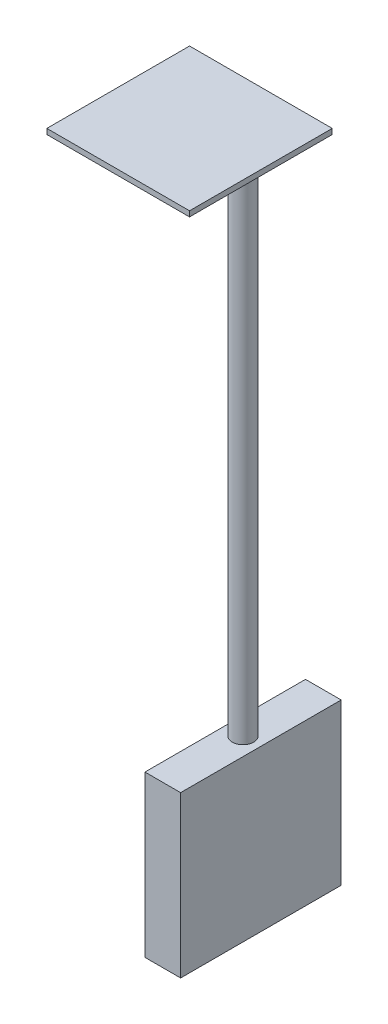
from build123d import *

# Parameters (mm, degrees)
ESQUISSE1_W        = 90
ESQUISSE1_H        = 90
BOSS_EXTRU_1_DEPTH = 20
ESQUISSE2_R        = 6
BOSS_EXTRU_2_DEPTH = 277
ESQUISSE3_W        = 80
ESQUISSE3_H        = 80
BOSS_EXTRU_3_DEPTH = 2.9
ESQUISSE4_W        = 80
ESQUISSE4_H        = 80
BOSS_EXTRU_4_DEPTH = 0.1


with BuildPart() as part:
    # Esquisse1 → Boss.-Extru.1 (new body)
    with BuildSketch(Plane(origin=(0, 0, 0), x_dir=(0, 0, -1), z_dir=(1, 0, 0))):
        with Locations((30.929303344, -12.964038863)):
            Rectangle(ESQUISSE1_W, ESQUISSE1_H)
    extrude(amount=BOSS_EXTRU_1_DEPTH)

    # Esquisse2 → Boss.-Extru.2 (add)
    with BuildSketch(Plane(origin=(0, 32.035961137, 0), x_dir=(1, 0, 0), z_dir=(0, 1, 0))):
        with Locations(Location((10, 30.929303344, 0), (0, 0, 90))):
            Circle(ESQUISSE2_R)
    extrude(amount=BOSS_EXTRU_2_DEPTH)

    # Esquisse3 → Boss.-Extru.3 (add)
    with BuildSketch(Plane(origin=(0, 309.035961137, 0), x_dir=(1, 0, 0), z_dir=(0, 1, 0))):
        with Locations((-20, 30.929303344)):
            Rectangle(ESQUISSE3_W, ESQUISSE3_H)
    extrude(amount=BOSS_EXTRU_3_DEPTH)

    # Esquisse4 → Boss.-Extru.4 (add)
    with BuildSketch(Plane(origin=(0, 311.935961137, 0), x_dir=(1, 0, 0), z_dir=(0, 1, 0))):
        with Locations((-20, 30.929303344)):
            Rectangle(ESQUISSE4_W, ESQUISSE4_H)
    extrude(amount=BOSS_EXTRU_4_DEPTH)


solid = part.part
